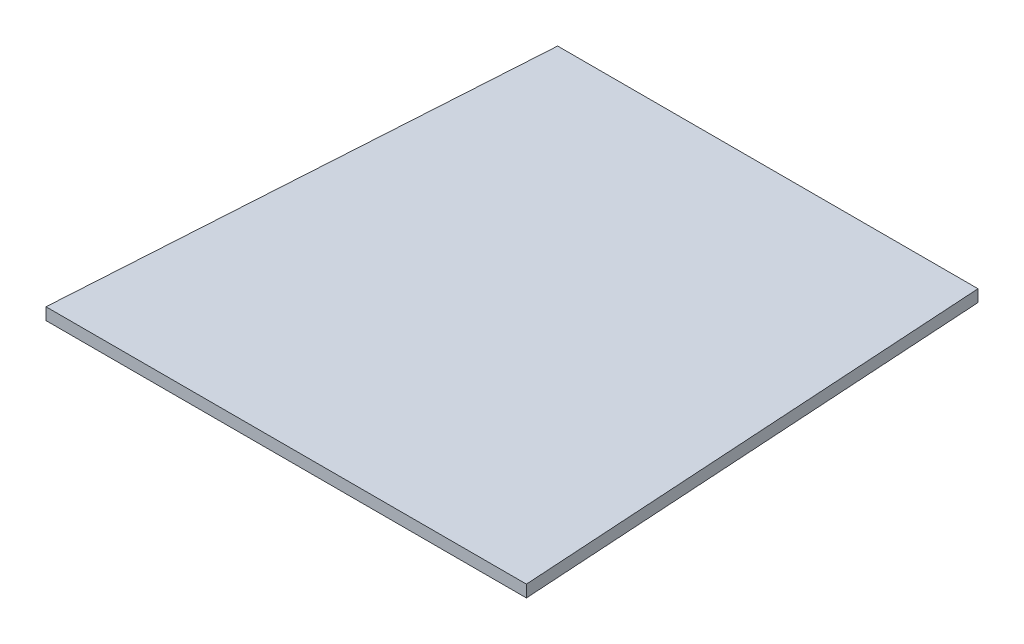
from build123d import *

# Parameters (mm, degrees)
DODANIE_WYCI_GNI_CIE1_DEPTH = 10


with BuildPart() as part:
    # Szkic1 → Dodanie-wyciągnięcie1 (new body)
    with BuildSketch(Plane(origin=(0, 0, 0), x_dir=(1, 0, 0), z_dir=(0, 1, 0))):
        Polygon((-200, -138.961038961), (-175, 262.038961039), (175, 262.038961039), (200, -138.961038961), align=None)
    extrude(amount=DODANIE_WYCI_GNI_CIE1_DEPTH)


solid = part.part
